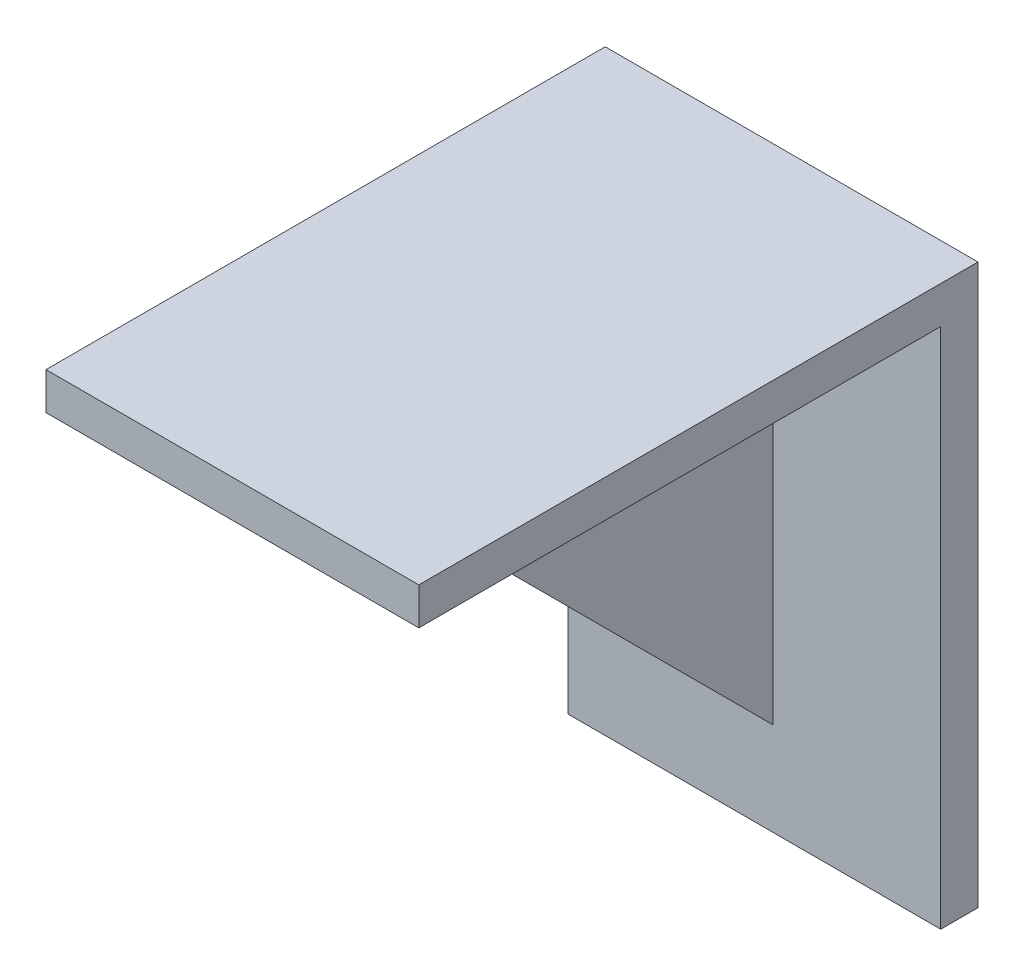
from build123d import *

# Parameters (mm, degrees)
SKETCH2_W           = 100
SKETCH2_H           = 150
BOSS_EXTRUDE1_DEPTH = 150
CUT_EXTRUDE1_DEPTH  = 235.520787991
CUT_EXTRUDE2_DEPTH  = 45


with BuildPart() as part:
    # Sketch2 → Boss-Extrude1 (new body)
    with BuildSketch(Plane(origin=(0, 0, 0), x_dir=(1, 0, 0), z_dir=(0, 1, 0))):
        with Locations((50, 75)):
            Rectangle(SKETCH2_W, SKETCH2_H)
    extrude(amount=BOSS_EXTRUDE1_DEPTH)

    # Sketch3 → Cut-Extrude1 (cut, through all)
    with BuildSketch(Plane.ZY):
        Polygon((0, 140), (-25, 140), (-140, 25), (-140, 0), (0, 0), align=None)
    extrude(amount=-CUT_EXTRUDE1_DEPTH, mode=Mode.SUBTRACT)

    # Sketch4 → Cut-Extrude2 (cut)
    with BuildSketch(Plane.ZY):
        Polygon((-140, 25), (-25, 140), (-140, 140), align=None)
    cut_extrude2 = extrude(amount=-CUT_EXTRUDE2_DEPTH, mode=Mode.SUBTRACT)

    # Mirror1: Cut-Extrude2 across plane
    add(cut_extrude2.mirror(Plane(origin=(50, 0, 0), x_dir=(0, 0, 1), z_dir=(1, 0, 0))), mode=Mode.SUBTRACT)


solid = part.part
